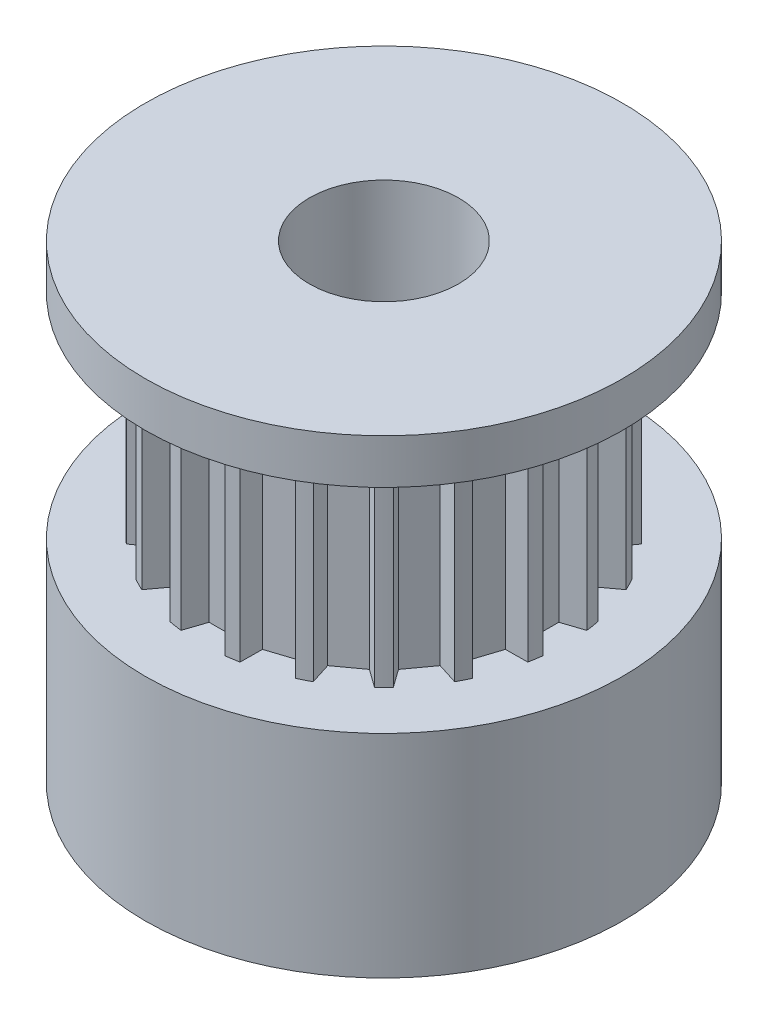
from build123d import *

# Parameters (mm, degrees)
SKETCH1_R           = 8
BOSS_EXTRUDE1_DEPTH = 7.1
SKETCH2_R           = 6.11
BOSS_EXTRUDE2_DEPTH = 7.14
SKETCH5_R           = 2.5
CUT_EXTRUDE2_DEPTH  = 16
CUT_EXTRUDE3_DEPTH  = 7.14
SKETCH8_R           = 8
BOSS_EXTRUDE4_DEPTH = 1.5
CUT_EXTRUDE4_START  = -15.74
SKETCH9_R           = 2.5
CUT_EXTRUDE4_DEPTH  = 15.74


with BuildPart() as part:
    # Sketch1 → Boss-Extrude1 (new body)
    with BuildSketch(Plane(origin=(0, 0, 0), x_dir=(1, 0, 0), z_dir=(0, 1, 0))):
        with Locations(Location((0, 0, 0), (0, 0, 270))):
            Circle(SKETCH1_R)
    extrude(amount=BOSS_EXTRUDE1_DEPTH)

    # Sketch2 → Boss-Extrude2 (add)
    with BuildSketch(Plane(origin=(0, 7.1, 0), x_dir=(1, 0, 0), z_dir=(0, 1, 0))):
        with Locations(Location((0, 0, 0), (0, 0, 270))):
            Circle(SKETCH2_R)
    extrude(amount=BOSS_EXTRUDE2_DEPTH)

    # Sketch5 → Cut-Extrude2 (cut)
    with BuildSketch(Plane.XZ):
        with Locations(Location((0, 0, 0), (0, 0, 270))):
            Circle(SKETCH5_R)
    extrude(amount=-CUT_EXTRUDE2_DEPTH, mode=Mode.SUBTRACT)

    # Sketch7 → Cut-Extrude3 (cut)
    with BuildSketch(Plane(origin=(0, 14.24, 0), x_dir=(1, 0, 0), z_dir=(0, 1, 0))):
        Polygon((-0.5, 5.36), (0.5, 5.36), (1, 6.86), (-1, 6.86), align=None)
        Polygon((3.070913098, 6.215230707), (2.131859348, 4.94315443), (1.180802832, 5.252171425), (1.168800065, 6.833264696), align=None)
        Polygon((4.841223825, 4.962071329), (3.555037449, 4.042438464), (2.746020455, 4.630223716), (3.223189836, 6.137641834), align=None)
        Polygon((6.137641834, 3.223189836), (4.630223716, 2.746020455), (4.042438464, 3.555037449), (4.962071329, 4.841223825), align=None)
        Polygon((6.833264696, 1.168800065), (5.252171425, 1.180802832), (4.94315443, 2.131859348), (6.215230707, 3.070913098), align=None)
        Polygon((6.86, -1), (5.36, -0.5), (5.36, 0.5), (6.86, 1), align=None)
        Polygon((6.215230707, -3.070913098), (4.94315443, -2.131859348), (5.252171425, -1.180802832), (6.833264696, -1.168800065), align=None)
        Polygon((4.962071329, -4.841223825), (4.042438464, -3.555037449), (4.630223716, -2.746020455), (6.137641834, -3.223189836), align=None)
        Polygon((3.223189836, -6.137641834), (2.746020455, -4.630223716), (3.555037449, -4.042438464), (4.841223825, -4.962071329), align=None)
        Polygon((1.168800065, -6.833264696), (1.180802832, -5.252171425), (2.131859348, -4.94315443), (3.070913098, -6.215230707), align=None)
        Polygon((-1, -6.86), (-0.5, -5.36), (0.5, -5.36), (1, -6.86), align=None)
        Polygon((-3.070913098, -6.215230707), (-2.131859348, -4.94315443), (-1.180802832, -5.252171425), (-1.168800065, -6.833264696), align=None)
        Polygon((-4.841223825, -4.962071329), (-3.555037449, -4.042438464), (-2.746020455, -4.630223716), (-3.223189836, -6.137641834), align=None)
        Polygon((-6.137641834, -3.223189836), (-4.630223716, -2.746020455), (-4.042438464, -3.555037449), (-4.962071329, -4.841223825), align=None)
        Polygon((-6.833264696, -1.168800065), (-5.252171425, -1.180802832), (-4.94315443, -2.131859348), (-6.215230707, -3.070913098), align=None)
        Polygon((-6.86, 1), (-5.36, 0.5), (-5.36, -0.5), (-6.86, -1), align=None)
        Polygon((-6.215230707, 3.070913098), (-4.94315443, 2.131859348), (-5.252171425, 1.180802832), (-6.833264696, 1.168800065), align=None)
        Polygon((-4.962071329, 4.841223825), (-4.042438464, 3.555037449), (-4.630223716, 2.746020455), (-6.137641834, 3.223189836), align=None)
        Polygon((-3.223189836, 6.137641834), (-2.746020455, 4.630223716), (-3.555037449, 4.042438464), (-4.841223825, 4.962071329), align=None)
        Polygon((-1.168800065, 6.833264696), (-1.180802832, 5.252171425), (-2.131859348, 4.94315443), (-3.070913098, 6.215230707), align=None)
    extrude(amount=-CUT_EXTRUDE3_DEPTH, mode=Mode.SUBTRACT)

    # Sketch8 → Boss-Extrude4 (add)
    with BuildSketch(Plane(origin=(0, 14.24, 0), x_dir=(1, 0, 0), z_dir=(0, 1, 0))):
        with Locations(Location((0, 0, 0), (0, 0, 270))):
            Circle(SKETCH8_R)
    extrude(amount=BOSS_EXTRUDE4_DEPTH)

    # Sketch9 → Cut-Extrude4 (cut)
    with BuildSketch(Plane(origin=(0, 15.74, 0), x_dir=(1, 0, 0), z_dir=(0, 1, 0)).offset(CUT_EXTRUDE4_START)):
        with Locations(Location((0, 0, 0), (0, 0, 90))):
            Circle(SKETCH9_R)
    extrude(amount=CUT_EXTRUDE4_DEPTH, mode=Mode.SUBTRACT)


solid = part.part
